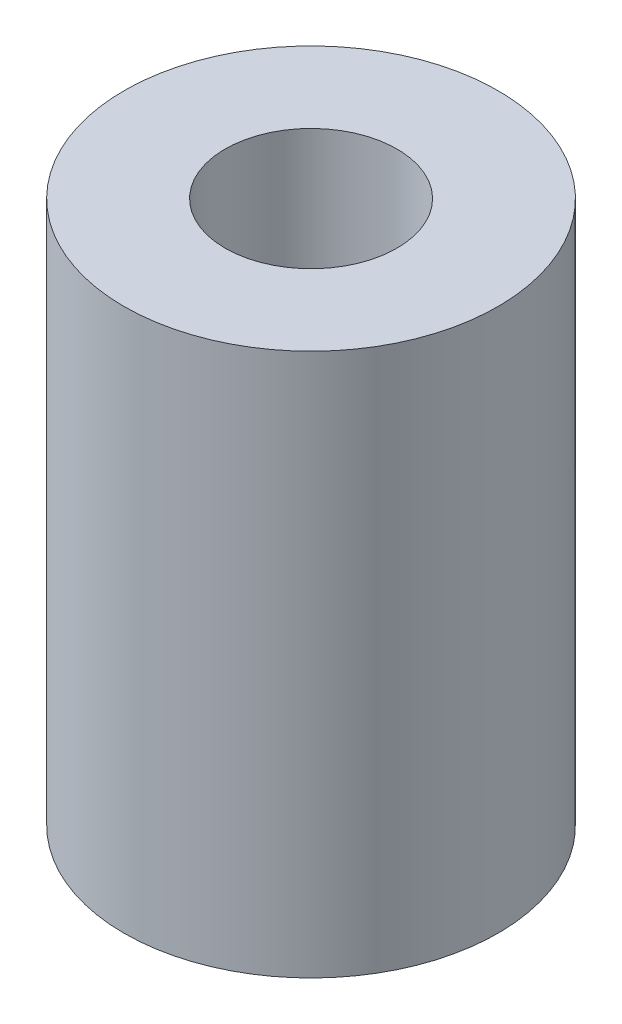
from build123d import *

# Parameters (mm, degrees)
SKETCH1_R           = 3.1
SKETCH1_R_2         = 1.425
BOSS_EXTRUDE1_DEPTH = 9


with BuildPart() as part:
    # Sketch1 → Boss-Extrude1 (new body)
    with BuildSketch(Plane(origin=(0, 0, 0), x_dir=(1, 0, 0), z_dir=(0, 1, 0))):
        with Locations(Location((0, 0, 0), (0, 0, 270))):
            Circle(SKETCH1_R)
        with Locations(Location((0, 0, 0), (0, 0, 270))):
            Circle(SKETCH1_R_2, mode=Mode.SUBTRACT)
    extrude(amount=BOSS_EXTRUDE1_DEPTH)


solid = part.part
